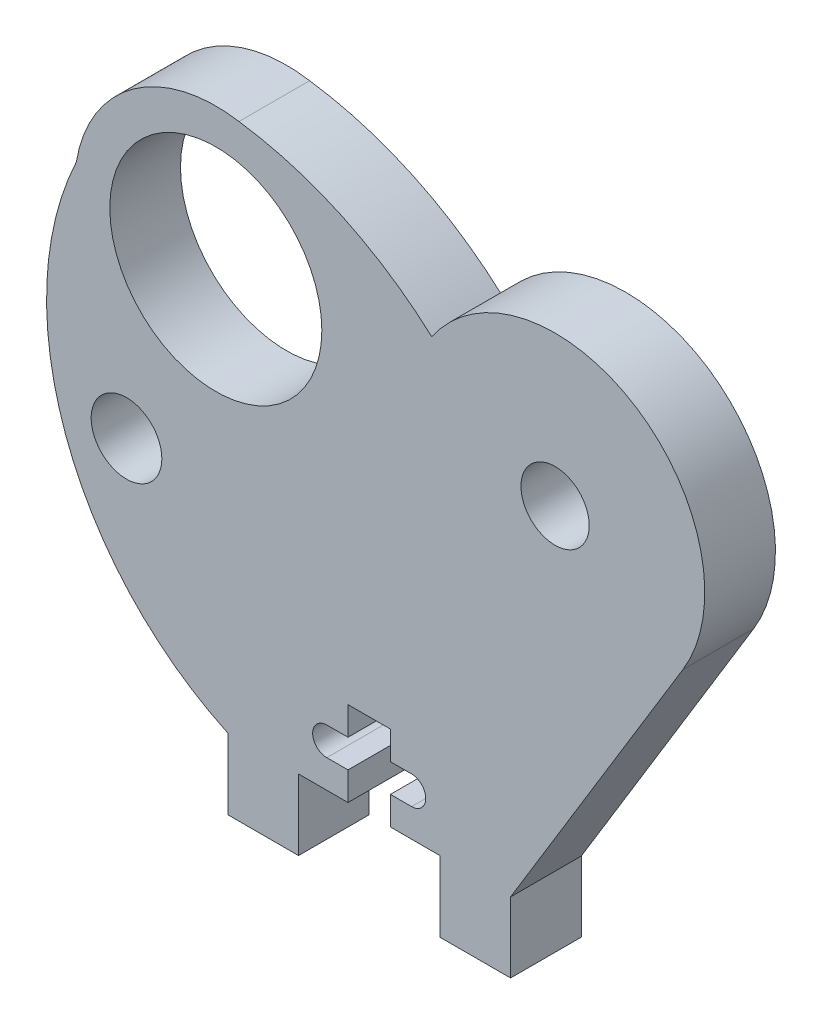
from build123d import *

# Parameters (mm, degrees)
SKETCH1_R           = 7.5
SKETCH1_R_2         = 2.5
SKETCH1_R_3         = 2.414891735
BOSS_EXTRUDE1_DEPTH = 5


with BuildPart() as part:
    # Sketch1 → Boss-Extrude1 (new body)
    with BuildSketch(Plane.XY):
        with BuildLine():
            Line((-64.11910774, -48), (-60.619119753, -48))
            Line((-60.619119753, -48), (-60.619119753, -46))
            Line((-60.619119753, -46), (-62.119119753, -46))
            ThreePointArc((-62.119119753, -46), (-63.119119753, -45), (-62.119119753, -44))
            Line((-62.119119753, -44), (-60.619119753, -44))
            Line((-60.619119753, -44), (-60.619119753, -42))
            Line((-60.619119753, -42), (-57.619119753, -42))
            Line((-57.619119753, -42), (-57.619119753, -44))
            Line((-57.619119753, -44), (-56.119119753, -44))
            ThreePointArc((-56.119119753, -44), (-55.119119753, -45), (-56.119119753, -46))
            Line((-56.119119753, -46), (-57.619119753, -46))
            Line((-57.619119753, -46), (-57.619119753, -48))
            Line((-57.619119753, -48), (-54.119131767, -48))
            Line((-54.119131767, -48), (-54.119131767, -53))
            Line((-54.119131767, -53), (-49.119131767, -53))
            Line((-49.119131767, -53), (-49.119131767, -48.03100166))
            Line((-49.119131767, -48.03100166), (-36.926389772, -28.007003911))
            ThreePointArc((-36.926389772, -28.007003911), (-40.215260186, -13.611740859), (-54.696043275, -16.500890917))
            ThreePointArc((-54.696043275, -16.500890917), (-61.035529103, -12.290355564), (-68.334240228, -10.134780364))
            ThreePointArc((-68.334240228, -10.134780364), (-75.789232267, -11.867196487), (-79.835711336, -18.363670844))
            ThreePointArc((-79.835711336, -18.363670844), (-80.615312561, -35.401323311), (-69.11910774, -48))
            Line((-69.11910774, -48), (-69.11910774, -53))
            Line((-69.11910774, -53), (-64.11910774, -53))
            Line((-64.11910774, -53), (-64.11910774, -48))
        make_face()
        with Locations((-69.970521887, -19.999973255)):
            Circle(SKETCH1_R, mode=Mode.SUBTRACT)
        with Locations((-76.288829656, -33.523643473)):
            Circle(SKETCH1_R_2, mode=Mode.SUBTRACT)
        with Locations((-45.970521887, -22.499973255)):
            Circle(SKETCH1_R_3, mode=Mode.SUBTRACT)
    extrude(amount=BOSS_EXTRUDE1_DEPTH)


solid = part.part
